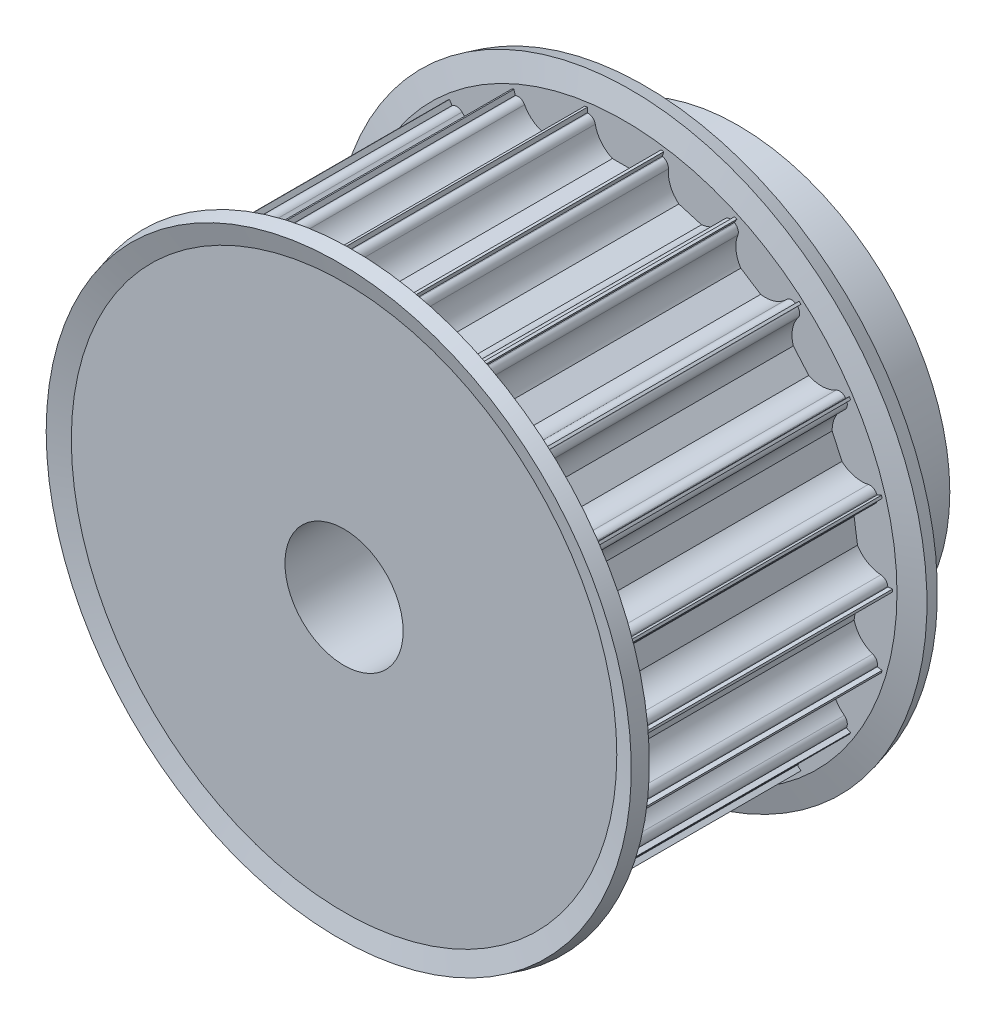
from build123d import *

# Parameters (mm, degrees)
CUT_EXTRUDE1_REACH = 57.544
CIRPATTERN1_COUNT  = 22


with BuildPart() as part:
    # Sketch1 → Revolve1 (revolve)
    with BuildSketch(Plane(origin=(0, 0, 0), x_dir=(0, 0, -1), z_dir=(1, 0, 0)), mode=Mode.PRIVATE) as revolve1_sk:
        Polygon((0, 6), (40, 6), (40, 21.5), (30, 21.5), (30, 27.25), (0, 27.25), align=None)
    revolve(revolve1_sk.sketch.rotate(Axis((0, 0, 0), (0, 0, -1)), 90), axis=Axis((0, 0, 0), (0, 0, -1)))

    # Sketch2 → Cut-Extrude1 (cut, up to next)
    with BuildSketch(Plane.XY, mode=Mode.PRIVATE) as cut_extrude1_sk1:
        with BuildLine():
            Line((-3.674234614, 26.5), (-3.75, 26.5))
            Line((-3.75, 26.5), (-3.75, 28.5))
            Line((-3.75, 28.5), (3.75, 28.5))
            Line((3.75, 28.5), (3.75, 26.5))
            Line((3.75, 26.5), (3.674234614, 26.5))
            ThreePointArc((3.674234614, 26.5), (3.199892965, 26.330947502), (2.939387691, 25.9))
            ThreePointArc((2.939387691, 25.9), (2.331759211, 24.612435701), (1.198957881, 23.75))
            Line((1.198957881, 23.75), (-1.198957881, 23.75))
            ThreePointArc((-1.198957881, 23.75), (-2.331759211, 24.612435701), (-2.939387691, 25.9))
            ThreePointArc((-2.939387691, 25.9), (-3.199892965, 26.330947502), (-3.674234614, 26.5))
        make_face()
    cut_extrude1_tool1 = extrude(cut_extrude1_sk1.sketch, amount=-CUT_EXTRUDE1_REACH, mode=Mode.PRIVATE) & part.part
    cut_extrude1 = cut_extrude1_tool1.solids().sort_by_distance((0, 26.435169, 0))[0]
    add(cut_extrude1, mode=Mode.SUBTRACT)

    # CirPattern1: Cut-Extrude1 ×22 about axis
    cirpattern1_axis = Axis((0, 0, 0), (0, 0, 1))
    for i in range(1, CIRPATTERN1_COUNT):
        add(cut_extrude1.rotate(cirpattern1_axis, i * 360 / CIRPATTERN1_COUNT), mode=Mode.SUBTRACT)

    # Sketch3 → Revolve2 (revolve)
    with BuildSketch(Plane(origin=(0, 0, 0), x_dir=(0, 0, -1), z_dir=(1, 0, 0)), mode=Mode.PRIVATE) as revolve2_sk:
        Polygon((30, 27.69), (30.539052531, 29.701771432), (29.090163791, 30.09), (28.447085729, 27.69), (28.447085729, 21.5), (30, 21.5), align=None)
        Polygon((0, 27.69), (-0.539052531, 29.701771432), (0.909836209, 30.09), (1.552914271, 27.69), (1.552914271, 21.5), (0, 21.5), align=None)
    revolve(revolve2_sk.sketch.rotate(Axis((0, 0, 0), (0, 0, 1)), 90), axis=Axis((0, 0, 0), (0, 0, 1)))


solid = part.part
